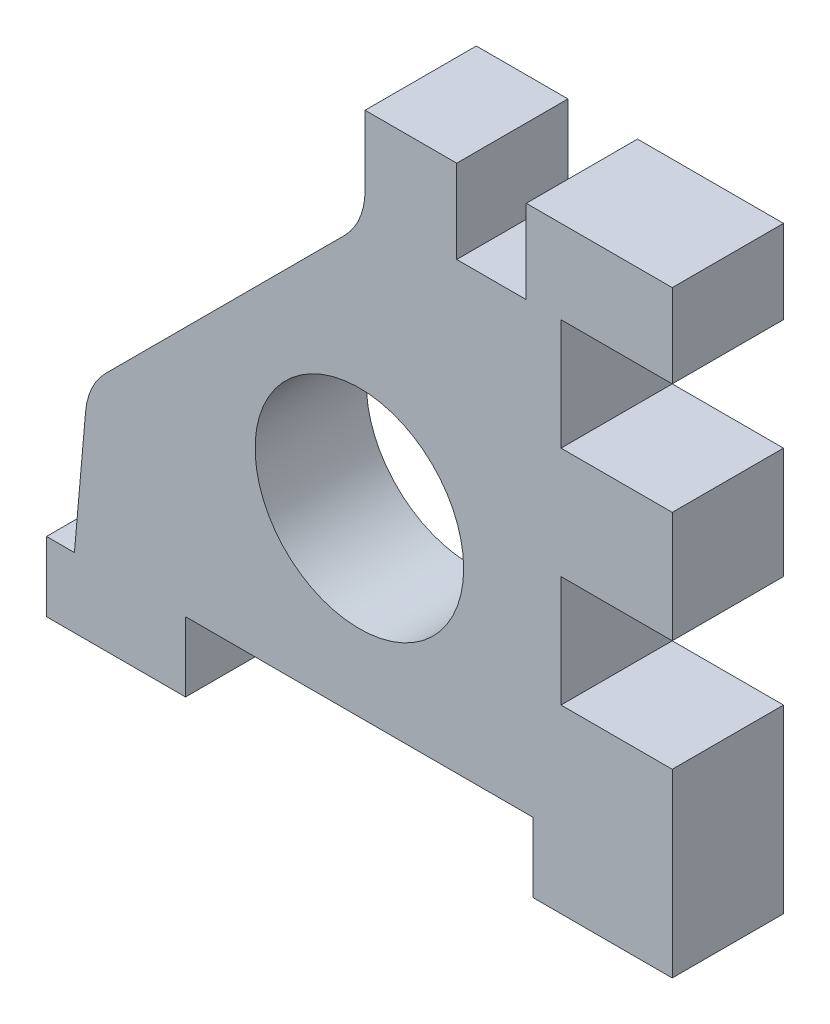
from build123d import *

# Parameters (mm, degrees)
SKETCH_1_R          = 7.5
EXTRUDE_1_DEPTH     = 8
FILLET_1_R          = 5
SKETCH_2_W          = 5
SKETCH_2_H          = 6
CUT_EXTRUDE_1_DEPTH = 8
SKETCH_3_W          = 10
SKETCH_3_H          = 8
EXTRUDE_2_DEPTH     = 5
SKETCH_4_W          = 8
SKETCH_4_H          = 8
CUT_EXTRUDE_2_DEPTH = 60.438258903


with BuildPart() as part:
    # 草图1 → 凸台-拉伸1 (new body)
    with BuildSketch(Plane.XY):
        Polygon((2.970014974, 11), (22.908786289, 30.938771315), (22.908786289, 37.998771315), (45, 37.998771315), (45, 0), (2.007639675, 0), align=None)
        with Locations((22.5, 13)):
            Circle(SKETCH_1_R, mode=Mode.SUBTRACT)
    extrude(amount=EXTRUDE_1_DEPTH)

    # 圆角1
    fillet_1_edges = [part.edges().sort_by_distance(p)[0] for p in [
        (2.970014974, 11, 4),
        (22.908786289, 30.938771315, 4),
    ]]
    fillet(fillet_1_edges, radius=FILLET_1_R)

    # 草图2 → 切除-拉伸1 (cut)
    with BuildSketch(Plane.XY.offset(8)):
        with Locations((32, 34.998771315)):
            Rectangle(SKETCH_2_W, SKETCH_2_H)
    extrude(amount=-CUT_EXTRUDE_1_DEPTH, mode=Mode.SUBTRACT)

    # 草图3 → 凸台-拉伸2 (add)
    with BuildSketch(Plane.XZ):
        with Locations((40, 4)):
            Rectangle(SKETCH_3_W, SKETCH_3_H)
        with Locations((5, 4)):
            Rectangle(SKETCH_3_W, SKETCH_3_H)
    extrude(amount=EXTRUDE_2_DEPTH)

    # 草图4 → 切除-拉伸2 (cut, through all)
    with BuildSketch(Plane.XY.offset(8)):
        with Locations((41, 12)):
            Rectangle(SKETCH_4_W, SKETCH_4_H)
        with Locations((41, 28)):
            Rectangle(SKETCH_4_W, SKETCH_4_H)
    extrude(amount=-CUT_EXTRUDE_2_DEPTH, mode=Mode.SUBTRACT)


solid = part.part
